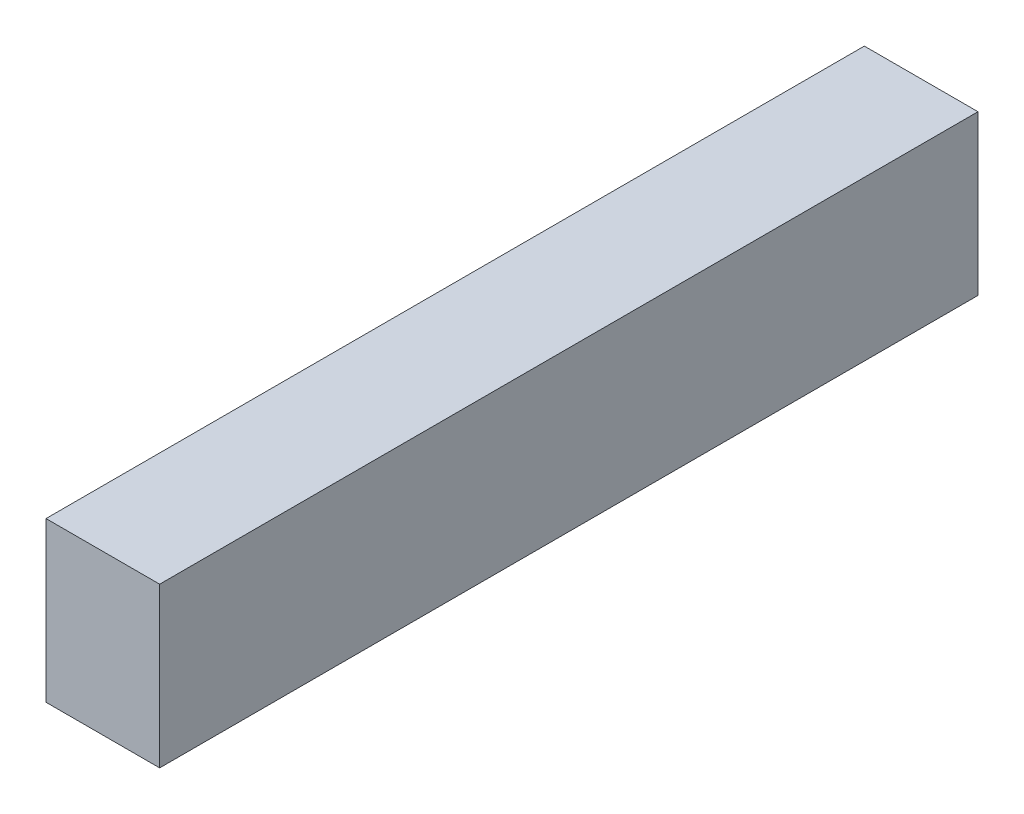
from build123d import *

# Parameters (mm, degrees)
SKETCH1_W           = 180
SKETCH1_H           = 35
BOSS_EXTRUDE1_DEPTH = 25


with BuildPart() as part:
    # Sketch1 → Boss-Extrude1 (new body)
    with BuildSketch(Plane(origin=(0, 0, 0), x_dir=(0, 0, -1), z_dir=(1, 0, 0))):
        Rectangle(SKETCH1_W, SKETCH1_H)
    extrude(amount=BOSS_EXTRUDE1_DEPTH)


solid = part.part
